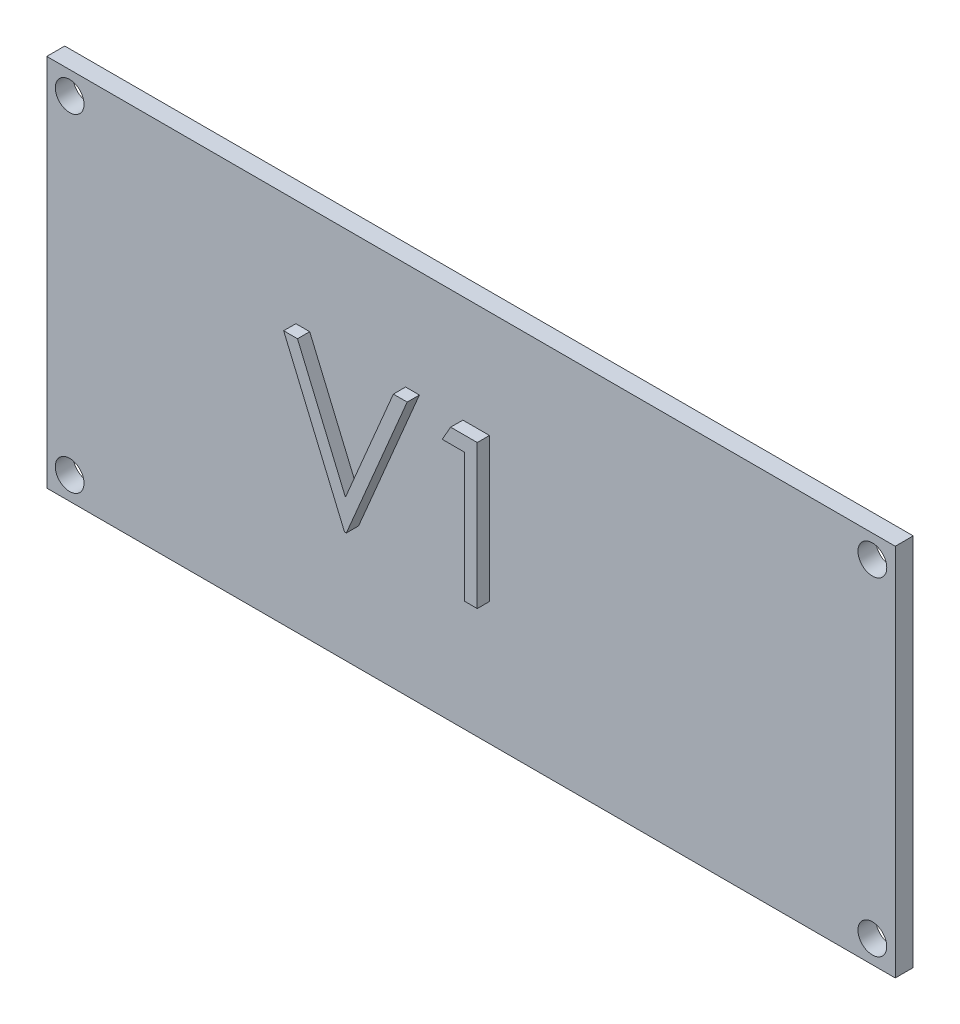
from build123d import *

# Parameters (mm, degrees)
SKETCH1_W           = 118
SKETCH1_H           = 52
SKETCH1_R           = 2
BOSS_EXTRUDE1_DEPTH = 2.5
BOSS_EXTRUDE2_DEPTH = 1.7


with BuildPart() as part:
    # Sketch1 → Boss-Extrude1 (new body)
    with BuildSketch(Plane.XY):
        with Locations((39.179079988, -106.041481737)):
            Rectangle(SKETCH1_W, SKETCH1_H)
        with Locations((-16.638939496, -128.859501222)):
            Circle(SKETCH1_R, mode=Mode.SUBTRACT)
        with Locations((94.997099473, -128.859501222)):
            Circle(SKETCH1_R, mode=Mode.SUBTRACT)
        with Locations((94.997099473, -83.223462252)):
            Circle(SKETCH1_R, mode=Mode.SUBTRACT)
        with Locations((-16.638939496, -83.223462252)):
            Circle(SKETCH1_R, mode=Mode.SUBTRACT)
    extrude(amount=BOSS_EXTRUDE1_DEPTH)

    # Sketch2 → Boss-Extrude2 (add)
    with BuildSketch(Plane.XY.offset(2.5)):
        Polygon((14.823144888, -94.914102462), (16.746221811, -94.914102462), (23.412888478, -110.67532041), (30.079555144, -94.914102462), (32.002632067, -94.914102462), (23.541093606, -114.914102462), (23.284683349, -114.914102462), align=None)
        Polygon((38.048305144, -94.914102462), (41.746221811, -94.914102462), (41.746221811, -114.914102462), (39.951350016, -114.914102462), (39.951350016, -96.965384513), (36.874426939, -96.965384513), align=None)
    extrude(amount=BOSS_EXTRUDE2_DEPTH)


solid = part.part
